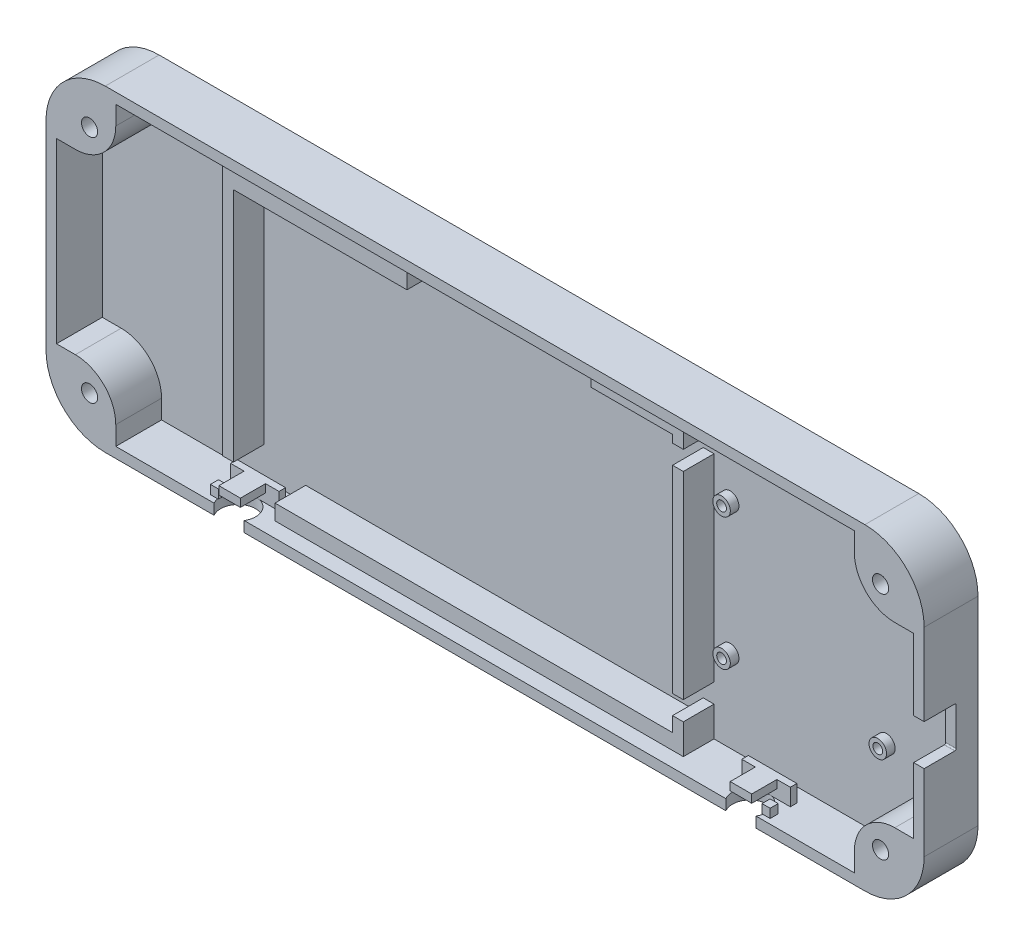
from build123d import *

# Parameters (mm, degrees)
SKETCH1_W            = 326
SKETCH1_H            = 117.8
SKETCH1_W_2          = 318.2
SKETCH1_H_2          = 110
BOSS_EXTRUDE1_DEPTH  = 20
SKETCH1_3_W          = 318.2
SKETCH1_3_H          = 110
BOSS_EXTRUDE2_DEPTH  = 3
BOSS_EXTRUDE6_START  = 3
SKETCH6_R            = 3.25
SKETCH6_R_2          = 1.8
BOSS_EXTRUDE6_DEPTH  = 3.2
FILLET1_R            = 22
CUT_EXTRUDE3_START   = 163
CUT_EXTRUDE3_DEPTH   = 3.9
CUT_EXTRUDE4_START   = 1.2
SKETCH6_2_R          = 1.8
CUT_EXTRUDE4_DEPTH   = 1.8
SKETCH5_W            = 64.404478897
SKETCH5_H            = 11.204693833
SKETCH5_W_2          = 4
SKETCH5_H_2          = 98.795306167
SKETCH5_W_3          = 30.218685567
SKETCH5_H_3          = 8.375486052
SKETCH5_H_4          = 73.388395798
SKETCH5_W_4          = 147.589311785
SKETCH5_H_5          = 5.740206696
BOSS_EXTRUDE7_DEPTH  = 14.4
CUT_EXTRUDE5_START   = -58.9
SKETCH10_R           = 6.5
CUT_EXTRUDE5_DEPTH   = 3.9
BOSS_EXTRUDE8_START  = -55
SKETCH11_W           = 18
SKETCH11_H           = 2.429995135
SKETCH11_W_2         = 3
SKETCH11_H_2         = 3
BOSS_EXTRUDE8_DEPTH  = 3.3
BOSS_EXTRUDE9_START  = -51.7
BOSS_EXTRUDE9_DEPTH  = 3
BOSS_EXTRUDE10_START = 3
SKETCH12_R           = 3
BOSS_EXTRUDE10_DEPTH = 17
SKETCH12_3_R         = 3
CUT_EXTRUDE6_DEPTH   = 6
SKETCH13_R           = 4.5
CUT_EXTRUDE7_DEPTH   = 4


with BuildPart() as part:
    # Sketch1 → Boss-Extrude1 (new body)
    with BuildSketch(Plane.XY):
        Rectangle(SKETCH1_W, SKETCH1_H)
        Rectangle(SKETCH1_W_2, SKETCH1_H_2, mode=Mode.SUBTRACT)
    extrude(amount=BOSS_EXTRUDE1_DEPTH)

    # Sketch1<3> → Boss-Extrude2 (add)
    with BuildSketch(Plane.XY):
        Rectangle(SKETCH1_3_W, SKETCH1_3_H)
    extrude(amount=BOSS_EXTRUDE2_DEPTH)

    # Sketch6 → Boss-Extrude6 (add)
    # profile 1 of 4: a face of its own
    with BuildSketch(Plane.XY.offset(BOSS_EXTRUDE6_START)):
        with Locations((132, -24.5)):
            Circle(SKETCH6_R)
        with Locations((132, -24.5)):
            Circle(SKETCH6_R_2, mode=Mode.SUBTRACT)
    # profile 2 of 4: a face of its own
    with BuildSketch(Plane.XY.offset(BOSS_EXTRUDE6_START)):
        with Locations((74, -24.5)):
            Circle(SKETCH6_R)
        with Locations((74, -24.5)):
            Circle(SKETCH6_R_2, mode=Mode.SUBTRACT)
    # profile 3 of 4: a face of its own
    with BuildSketch(Plane.XY.offset(BOSS_EXTRUDE6_START)):
        with Locations((74, 24.5)):
            Circle(SKETCH6_R)
        with Locations((74, 24.5)):
            Circle(SKETCH6_R_2, mode=Mode.SUBTRACT)
    # profile 4 of 4: a face of its own
    with BuildSketch(Plane.XY.offset(BOSS_EXTRUDE6_START)):
        with Locations((132, 24.5)):
            Circle(SKETCH6_R)
        with Locations((132, 24.5)):
            Circle(SKETCH6_R_2, mode=Mode.SUBTRACT)
    extrude(amount=BOSS_EXTRUDE6_DEPTH)

    # Fillet1
    fillet1_edges = [part.edges().sort_by_distance(p)[0] for p in [
        (163, 58.9, 10),
        (163, -58.9, 10),
        (-163, -58.9, 10),
        (-163, 58.9, 10),
        (159.1, 55, 11.5),
        (-159.1, 55, 11.5),
        (-159.1, -55, 11.5),
        (159.1, -55, 11.5),
    ]]
    fillet(fillet1_edges, radius=FILLET1_R)

    # Sketch9 → Cut-Extrude3 (cut)
    with BuildSketch(Plane(origin=(0, 0, 0), x_dir=(0, 0, -1), z_dir=(1, 0, 0)).offset(CUT_EXTRUDE3_START)):
        with BuildLine():
            Line((-20, -8.55), (-8.58, -8.55))
            ThreePointArc((-8.58, -8.55), (-8.226446609, -8.403553391), (-8.08, -8.05))
            Line((-8.08, -8.05), (-8.08, 6.05))
            ThreePointArc((-8.08, 6.05), (-8.226446609, 6.403553391), (-8.58, 6.55))
            Line((-8.58, 6.55), (-20, 6.55))
            Line((-20, 6.55), (-20, -8.55))
        make_face()
    extrude(amount=-CUT_EXTRUDE3_DEPTH, mode=Mode.SUBTRACT)

    # Sketch6<2> → Cut-Extrude4 (cut)
    with BuildSketch(Plane.XY.offset(CUT_EXTRUDE4_START)):
        with Locations((132, -24.5)):
            Circle(SKETCH6_2_R)
        with Locations((132, 24.5)):
            Circle(SKETCH6_2_R)
        with Locations((74, 24.5)):
            Circle(SKETCH6_2_R)
        with Locations((74, -24.5)):
            Circle(SKETCH6_2_R)
    extrude(amount=CUT_EXTRUDE4_DEPTH, mode=Mode.SUBTRACT)

    # Sketch5 → Boss-Extrude7 (add)
    with BuildSketch(Plane.XY):
        with Locations((-66.797760552, 49.397653084)):
            Rectangle(SKETCH5_W, SKETCH5_H)
        with Locations((-101, 5.602346917)):
            Rectangle(SKETCH5_W_2, SKETCH5_H_2)
        with Locations((48.890657217, 50.812256974)):
            Rectangle(SKETCH5_W_3, SKETCH5_H_3)
        with Locations((66, 49.397653084)):
            Rectangle(SKETCH5_W_2, SKETCH5_H)
        with Locations((66, 0)):
            Rectangle(SKETCH5_W_2, SKETCH5_H_4)
        with Locations((-9.794655893, -52.129896652)):
            Rectangle(SKETCH5_W_4, SKETCH5_H_5)
        with Locations((66, -49.397653084)):
            Rectangle(SKETCH5_W_2, SKETCH5_H)
    extrude(amount=BOSS_EXTRUDE7_DEPTH)

    # Sketch10 → Cut-Extrude5 (cut)
    with BuildSketch(Plane(origin=(0, 0, 0), x_dir=(1, 0, 0), z_dir=(0, 1, 0)).offset(CUT_EXTRUDE5_START)):
        with Locations((95, -16.665643961)):
            Circle(SKETCH10_R)
        with Locations((-95, -16.665643961)):
            Circle(SKETCH10_R)
    extrude(amount=CUT_EXTRUDE5_DEPTH, mode=Mode.SUBTRACT)

    # Sketch11 → Boss-Extrude8 (add)
    with BuildSketch(Plane(origin=(0, 0, 0), x_dir=(1, 0, 0), z_dir=(0, 1, 0)).offset(BOSS_EXTRUDE8_START)):
        Polygon((-104.033941149, -14.931036323), (-101.03394878, -14.937802738), (-101.040715195, -17.937795107), (-104.040707565, -17.931028692), align=None)
        Polygon((-86.018356525, -8.041657306), (-104.018310741, -8.001058815), (-104.023791526, -10.431047769), (-86.023837311, -10.47164626), align=None)
        with Locations((95, -9.450646394)):
            Rectangle(SKETCH11_W, SKETCH11_H)
        with Locations((102.5, -16.665643961)):
            Rectangle(SKETCH11_W_2, SKETCH11_H_2)
    extrude(amount=BOSS_EXTRUDE8_DEPTH)

    # Sketch11<3> → Boss-Extrude9 (add)
    with BuildSketch(Plane(origin=(0, 0, 0), x_dir=(1, 0, 0), z_dir=(0, 1, 0)).offset(BOSS_EXTRUDE9_START)):
        Polygon((86, -8.235648826), (86, -10.665643961), (91, -10.665643961), (91, -20), (99, -20), (99, -10.665643961), (104, -10.665643961), (104, -8.235648826), align=None)
        Polygon((-104.023791526, -10.431047769), (-99.023804244, -10.442325128), (-99.044857621, -19.776657424), (-91.044877969, -19.794701198), (-91.023824593, -10.460368902), (-86.023837311, -10.47164626), (-86.018356525, -8.041657306), (-104.018310741, -8.001058815), align=None)
    extrude(amount=BOSS_EXTRUDE9_DEPTH)

    # Sketch12 → Boss-Extrude10 (add)
    # profile 1 of 4: a face of its own
    with BuildSketch(Plane.XY.offset(BOSS_EXTRUDE10_START)):
        with BuildLine():
            Line((-137.1, -55), (-137.1, -48))
            ThreePointArc((-137.1, -48), (-141.493398282, -37.393398282), (-152.1, -33))
            Line((-152.1, -33), (-159.1, -33))
            ThreePointArc((-159.1, -33), (-152.656349186, -48.556349186), (-137.1, -55))
        make_face()
        with Locations((-146.828174593, -42.728174593)):
            Circle(SKETCH12_R, mode=Mode.SUBTRACT)
    # profile 2 of 4: a face of its own
    with BuildSketch(Plane.XY.offset(BOSS_EXTRUDE10_START)):
        with BuildLine():
            ThreePointArc((-137.1, 48), (-141.493398282, 37.393398282), (-152.1, 33))
            Line((-152.1, 33), (-159.1, 33))
            ThreePointArc((-159.1, 33), (-152.656349186, 48.556349186), (-137.1, 55))
            Line((-137.1, 55), (-137.1, 48))
        make_face()
        with Locations((-146.828174593, 42.728174593)):
            Circle(SKETCH12_R, mode=Mode.SUBTRACT)
    # profile 3 of 4: a face of its own
    with BuildSketch(Plane.XY.offset(BOSS_EXTRUDE10_START)):
        with BuildLine():
            ThreePointArc((152.1, 33), (141.493398282, 37.393398282), (137.1, 48))
            Line((137.1, 48), (137.1, 55))
            ThreePointArc((137.1, 55), (152.656349186, 48.556349186), (159.1, 33))
            Line((159.1, 33), (152.1, 33))
        make_face()
        with Locations((146.828174593, 42.728174593)):
            Circle(SKETCH12_R, mode=Mode.SUBTRACT)
    # profile 4 of 4: a face of its own
    with BuildSketch(Plane.XY.offset(BOSS_EXTRUDE10_START)):
        with BuildLine():
            ThreePointArc((137.1, -48), (141.493398282, -37.393398282), (152.1, -33))
            Line((152.1, -33), (159.1, -33))
            ThreePointArc((159.1, -33), (152.656349186, -48.556349186), (137.1, -55))
            Line((137.1, -55), (137.1, -48))
        make_face()
        with Locations((146.828174593, -42.728174593)):
            Circle(SKETCH12_R, mode=Mode.SUBTRACT)
    extrude(amount=BOSS_EXTRUDE10_DEPTH)

    # Sketch12<3> → Cut-Extrude6 (cut)
    with BuildSketch(Plane.XY):
        with Locations((146.828174593, 42.728174593)):
            Circle(SKETCH12_3_R)
        with Locations((146.828174593, -42.728174593)):
            Circle(SKETCH12_3_R)
        with Locations((-146.828174593, -42.728174593)):
            Circle(SKETCH12_3_R)
        with Locations((-146.828174593, 42.728174593)):
            Circle(SKETCH12_3_R)
    extrude(amount=CUT_EXTRUDE6_DEPTH, mode=Mode.SUBTRACT)

    # Sketch13 → Cut-Extrude7 (cut)
    with BuildSketch(Plane.XY):
        with Locations((-146.828174593, -42.728174593)):
            Circle(SKETCH13_R)
        with Locations((-146.828174593, 42.728174593)):
            Circle(SKETCH13_R)
        with Locations((146.828174593, 42.728174593)):
            Circle(SKETCH13_R)
        with Locations((146.828174593, -42.728174593)):
            Circle(SKETCH13_R)
    extrude(amount=CUT_EXTRUDE7_DEPTH, mode=Mode.SUBTRACT)


solid = part.part
